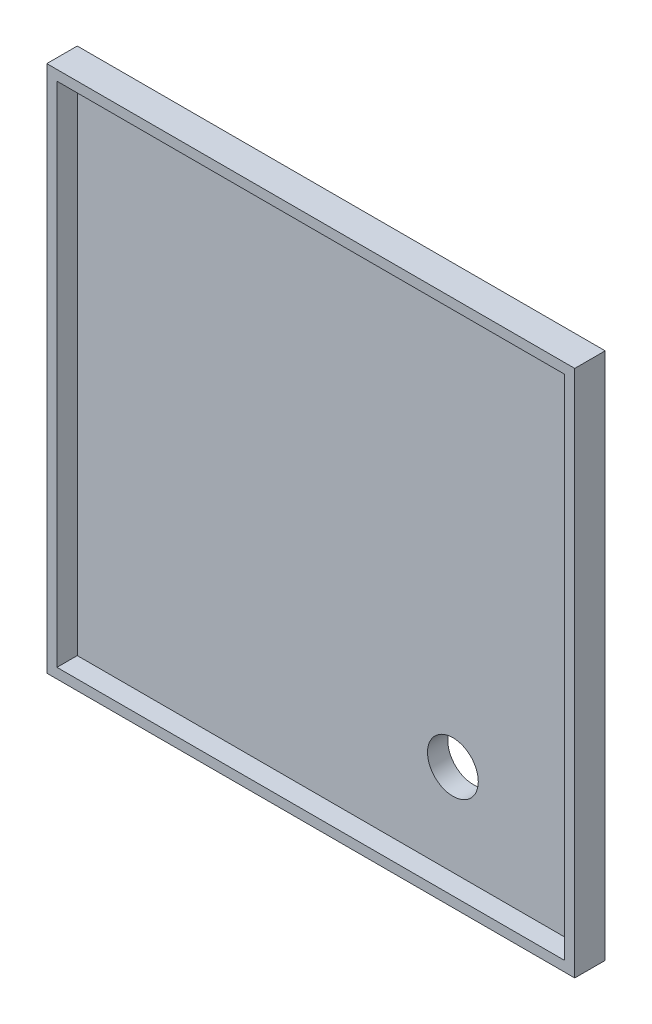
from build123d import *

# Parameters (mm, degrees)
ESQUISSE1_W             = 520
ESQUISSE1_H             = 520
BOSS_EXTRU_1_DEPTH      = 10
ESQUISSE2_W             = 480
ESQUISSE2_H             = 480
BOSS_EXTRU_2_DEPTH      = 10
ESQUISSE3_W             = 520
ESQUISSE3_H             = 520
ESQUISSE3_W_2           = 500
ESQUISSE3_H_2           = 500
BOSS_EXTRU_3_DEPTH      = 20
ESQUISSE4_R             = 25
ENL_V_MAT_EXTRU_1_DEPTH = 737.002717386


with BuildPart() as part:
    # Esquisse1 → Boss.-Extru.1 (new body)
    with BuildSketch(Plane.XY):
        with Locations((260, 260)):
            Rectangle(ESQUISSE1_W, ESQUISSE1_H)
    extrude(amount=BOSS_EXTRU_1_DEPTH)

    # Esquisse2 → Boss.-Extru.2 (add)
    with BuildSketch(Plane.XY.offset(10)):
        with Locations((260, 260)):
            Rectangle(ESQUISSE2_W, ESQUISSE2_H)
    extrude(amount=BOSS_EXTRU_2_DEPTH)

    # Esquisse3 → Boss.-Extru.3 (add)
    with BuildSketch(Plane.XY.offset(10)):
        with Locations((260, 260)):
            Rectangle(ESQUISSE3_W, ESQUISSE3_H)
        with Locations((260, 260)):
            Rectangle(ESQUISSE3_W_2, ESQUISSE3_H_2, mode=Mode.SUBTRACT)
    extrude(amount=BOSS_EXTRU_3_DEPTH)

    # Esquisse4 → Enlèv. mat.-Extru.1 (cut, through all)
    with BuildSketch(Plane(origin=(0, 0, 0), x_dir=(-1, 0, 0), z_dir=(0, 0, -1))):
        with Locations((-390, 110)):
            Circle(ESQUISSE4_R)
    extrude(amount=-ENL_V_MAT_EXTRU_1_DEPTH, mode=Mode.SUBTRACT)


solid = part.part
